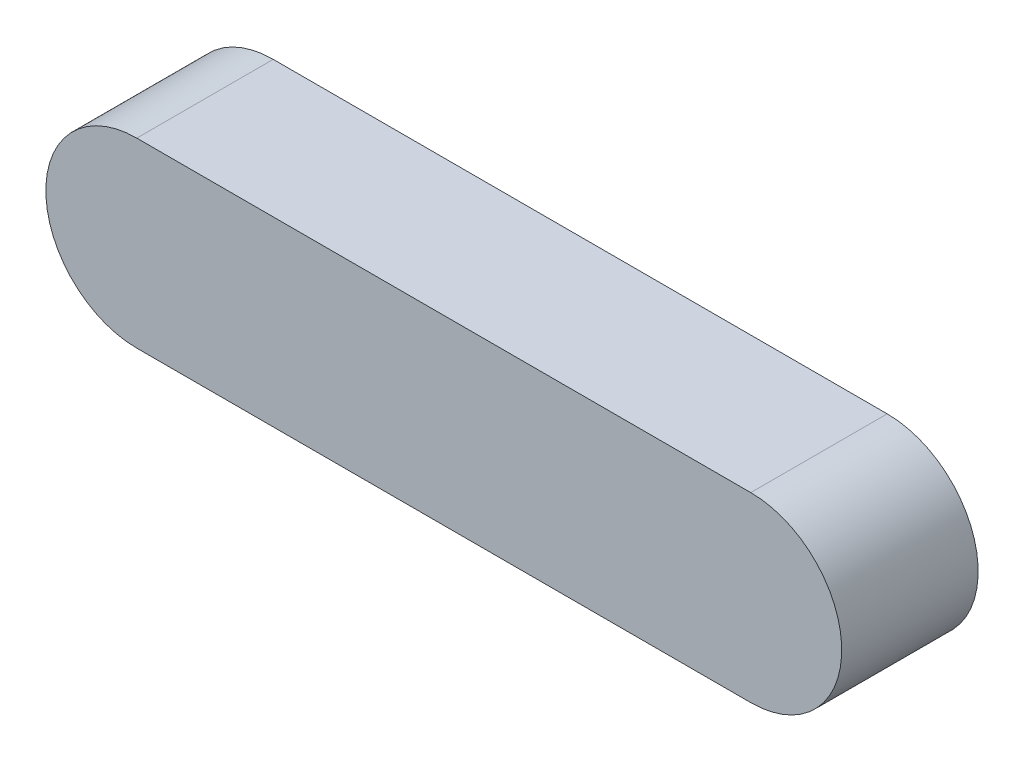
from build123d import *

# Parameters (mm, degrees)
BOSS_EXTRUDE1_DEPTH = 12


with BuildPart() as part:
    # Sketch1 → Boss-Extrude1 (new body)
    with BuildSketch(Plane.XY):
        with BuildLine():
            Line((-27, 8), (27, 8))
            ThreePointArc((27, 8), (35, 0), (27, -8))
            Line((27, -8), (-27, -8))
            ThreePointArc((-27, -8), (-35, 0), (-27, 8))
        make_face()
    extrude(amount=BOSS_EXTRUDE1_DEPTH)


solid = part.part
